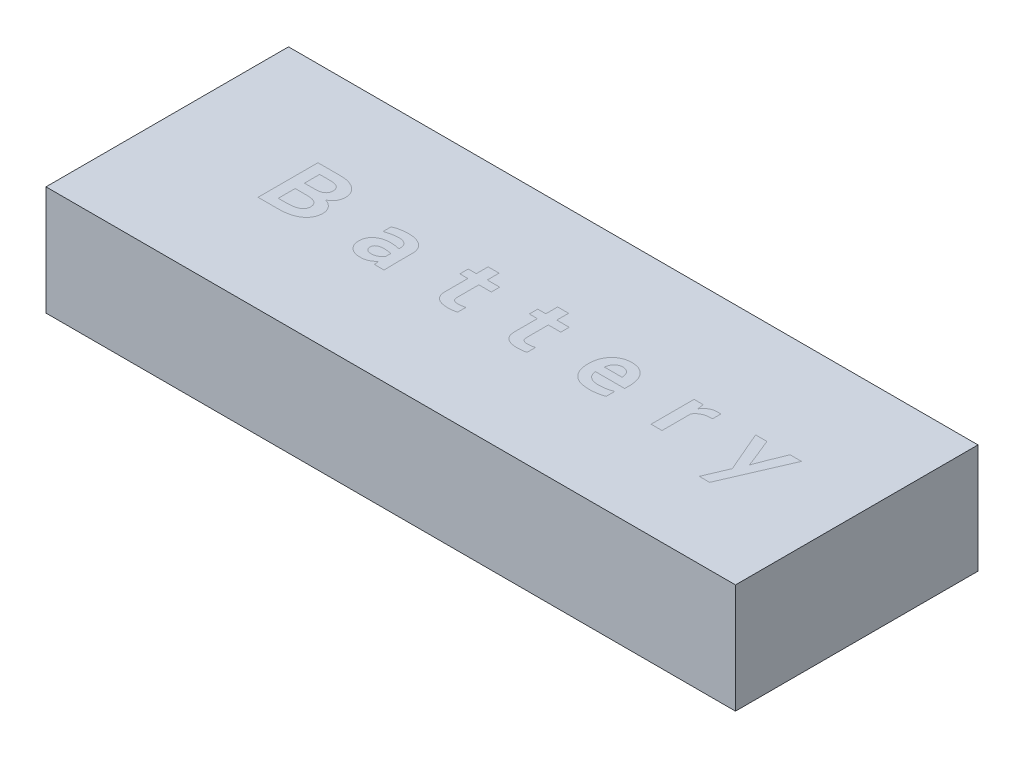
from build123d import *

# Parameters (mm, degrees)
SKETCH1_W           = 145
SKETCH1_H           = 51
BOSS_EXTRUDE1_DEPTH = 23


with BuildPart() as part:
    # Sketch1 → Boss-Extrude1 (new body)
    with BuildSketch(Plane(origin=(0, 0, 0), x_dir=(1, 0, 0), z_dir=(0, 1, 0))):
        with Locations((72.5, 25.5)):
            Rectangle(SKETCH1_W, SKETCH1_H)
    extrude(amount=BOSS_EXTRUDE1_DEPTH)


solid = part.part
